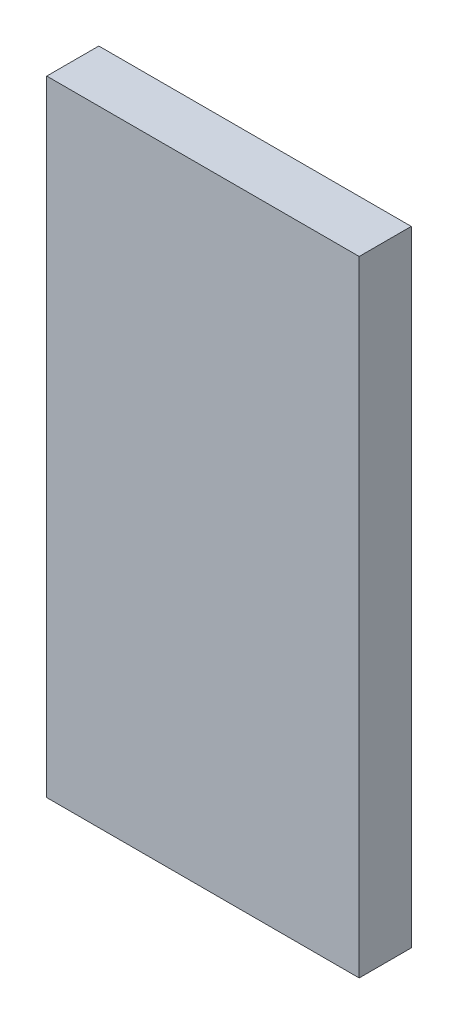
from build123d import *

# Parameters (mm, degrees)
SKETCH1_W           = 152.4
SKETCH1_H           = 304.8
BOSS_EXTRUDE1_DEPTH = 25.4


with BuildPart() as part:
    # Sketch1 → Boss-Extrude1 (new body)
    with BuildSketch(Plane.XY):
        Rectangle(SKETCH1_W, SKETCH1_H)
    extrude(amount=BOSS_EXTRUDE1_DEPTH)


solid = part.part
